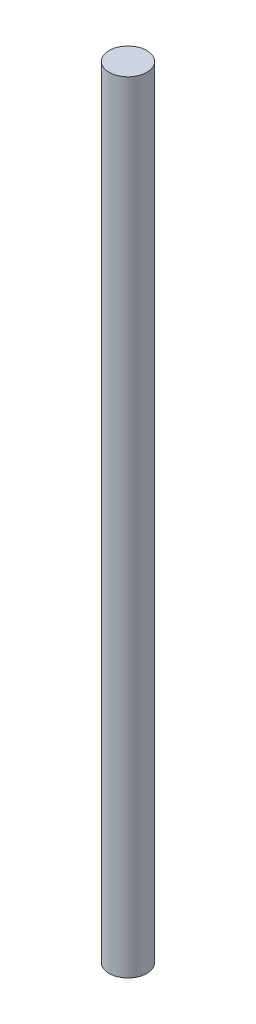
from build123d import *

# Parameters (mm, degrees)
SKETCH_1_R      = 2.9
EXTRUDE_1_DEPTH = 120


with BuildPart() as part:
    # 草图1 → 凸台-拉伸1 (new body)
    with BuildSketch(Plane(origin=(0, 0, 0), x_dir=(1, 0, 0), z_dir=(0, 1, 0))):
        with Locations(Location((0, 0, 0), (0, 0, 270))):
            Circle(SKETCH_1_R)
    extrude(amount=EXTRUDE_1_DEPTH)


solid = part.part
